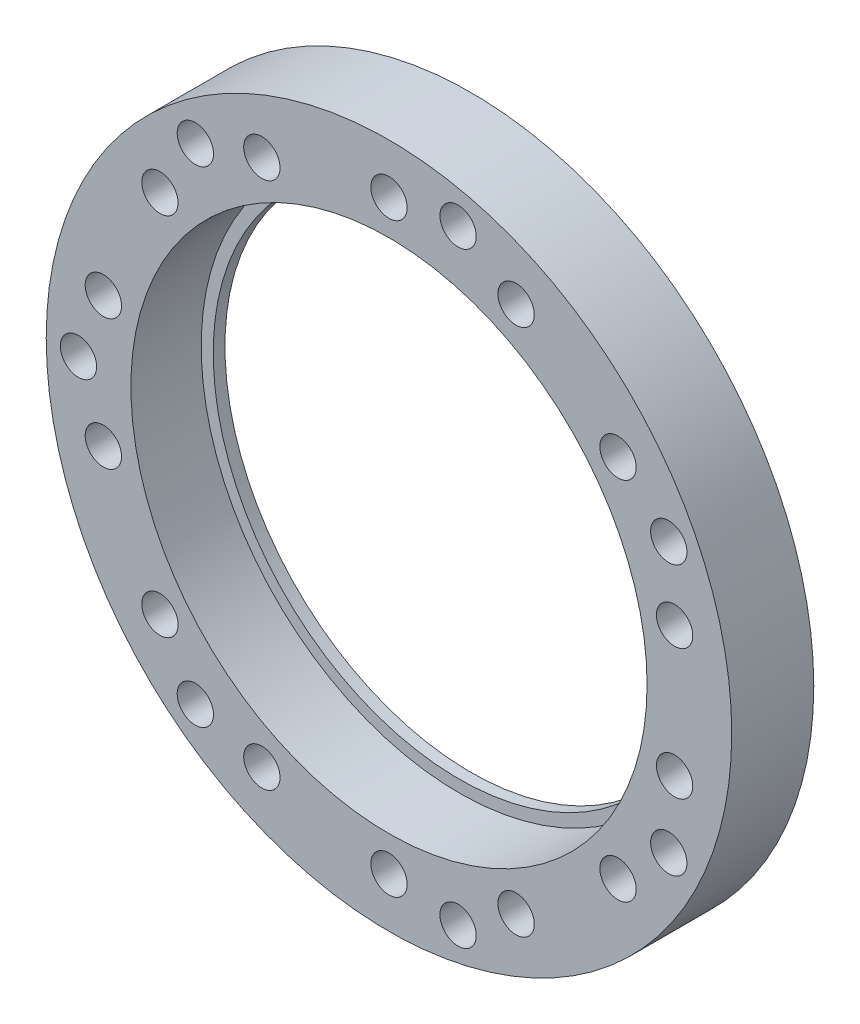
from build123d import *

# Parameters (mm, degrees)
SKETCH1_R           = 29.25
SKETCH1_R_2         = 22.025
BOSS_EXTRUDE1_DEPTH = 7
CUT_EXTRUDE1_START  = 7
SKETCH1_3_R         = 1.55
CUT_EXTRUDE1_DEPTH  = 4
SKETCH4_R           = 22.25
SKETCH4_R_2         = 21
BOSS_EXTRUDE2_DEPTH = 1
SKETCH3_R           = 1.55
CUT_EXTRUDE2_DEPTH  = 42.953843686


with BuildPart() as part:
    # Sketch1 → Boss-Extrude1 (new body)
    with BuildSketch(Plane.XY):
        Circle(SKETCH1_R)
        Circle(SKETCH1_R_2, mode=Mode.SUBTRACT)
    extrude(amount=BOSS_EXTRUDE1_DEPTH)

    # Sketch1<3> → Cut-Extrude1 (cut)
    with BuildSketch(Plane.XY.offset(CUT_EXTRUDE1_START)):
        with Locations((0, 25)):
            Circle(SKETCH1_3_R)
        with Locations((10.847093478, 22.524221698)):
            Circle(SKETCH1_3_R)
        with Locations((19.545787062, 15.587245046)):
            Circle(SKETCH1_3_R)
        with Locations((24.373197805, 5.563023349)):
            Circle(SKETCH1_3_R)
        with Locations((24.373197805, -5.563023349)):
            Circle(SKETCH1_3_R)
        with Locations((19.545787062, -15.587245046)):
            Circle(SKETCH1_3_R)
        with Locations((10.847093478, -22.524221698)):
            Circle(SKETCH1_3_R)
        with Locations((0, -25)):
            Circle(SKETCH1_3_R)
        with Locations((-10.847093478, -22.524221698)):
            Circle(SKETCH1_3_R)
        with Locations((-19.545787062, -15.587245046)):
            Circle(SKETCH1_3_R)
        with Locations((-24.373197805, -5.563023349)):
            Circle(SKETCH1_3_R)
        with Locations((-24.373197805, 5.563023349)):
            Circle(SKETCH1_3_R)
        with Locations((-19.545787062, 15.587245046)):
            Circle(SKETCH1_3_R)
        with Locations((-10.847093478, 22.524221698)):
            Circle(SKETCH1_3_R)
    extrude(amount=-CUT_EXTRUDE1_DEPTH, mode=Mode.SUBTRACT)

    # Sketch4 → Boss-Extrude2 (add)
    with BuildSketch(Plane.XY):
        Circle(SKETCH4_R)
        Circle(SKETCH4_R_2, mode=Mode.SUBTRACT)
    extrude(amount=BOSS_EXTRUDE2_DEPTH)

    # Sketch3 → Cut-Extrude2 (cut, through all)
    with BuildSketch(Plane.XY):
        with Locations((5.89680475, 25.835589673)):
            Circle(SKETCH3_R)
        with Locations((23.875674999, 11.497919087)):
            Circle(SKETCH3_R)
        with Locations((23.875674999, -11.497919087)):
            Circle(SKETCH3_R)
        with Locations((5.89680475, -25.835589673)):
            Circle(SKETCH3_R)
        with Locations((-16.522479749, -20.718534285)):
            Circle(SKETCH3_R)
        with Locations((-26.5, 0)):
            Circle(SKETCH3_R)
        with Locations((-16.522479749, 20.718534285)):
            Circle(SKETCH3_R)
    extrude(amount=CUT_EXTRUDE2_DEPTH, mode=Mode.SUBTRACT)


solid = part.part
